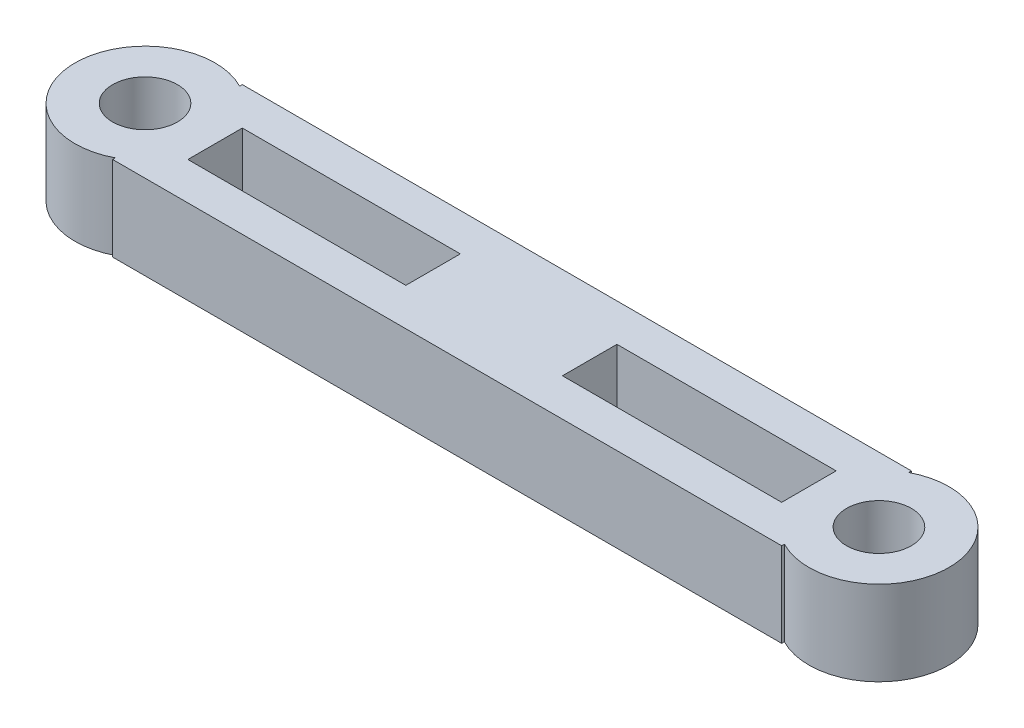
from build123d import *

# Parameters (mm, degrees)
SKETCH1_W                = 22.609360872
SKETCH1_H                = 4.3815
SKETCH1_W_2              = 7.366
SKETCH1_H_2              = 1.8415
SKETCH1_W_3              = 7.407296779
BOSS_EXTRUDE1_DEPTH      = 6.35
BOSS_EXTRUDE2_REACH      = 15.15
BOSS_EXTRUDE3_START      = 2.19075
BOSS_EXTRUDE3_DEPTH      = 2.19075
SKETCH7_R                = 1.5875
BOSS_EXTRUDE4_DEPTH      = 1.27
MIRROR2_COPY_1_SKETCH_R  = 1.5875
MIRROR2_COPY_1_DEPTH     = 1.27
BOSS_EXTRUDE5_DEPTH      = 6.35
BOSS_EXTRUDE5_DEPTH_BACK = 1.27
SKETCH8_R                = 0.635
SKETCH9_W                = 22.609360872
SKETCH9_H                = 6.35
BOSS_EXTRUDE6_DEPTH      = 4.3815
SKETCH10_W               = 6.35
SKETCH10_H               = 1.8415
CUT_EXTRUDE1_DEPTH       = 12.7
CUT_EXTRUDE2_DEPTH       = 23.114
CUT_EXTRUDE2_DEPTH_BACK  = 4.7625
SKETCH12_W               = 31.633822951
SKETCH12_H               = 14.456952732
SKETCH13_W               = 7.366
SKETCH13_H               = 1.8415
SKETCH13_W_2             = 7.407296779
CUT_EXTRUDE3_DEPTH       = 12.7
SKETCH15_W               = 5.299628269
SKETCH15_H               = 4.3815
SKETCH15_W_2             = 5.528427798
CUT_EXTRUDE5_DEPTH       = 2.8575
SKETCH14_R               = 2.367055436
SKETCH14_R_2             = 1.095375
BOSS_EXTRUDE9_DEPTH      = 2.8575


with BuildPart() as part:
    # Sketch1 → Boss-Extrude1 (new body)
    with BuildSketch(Plane(origin=(0, 0, 0), x_dir=(1, 0, 0), z_dir=(0, 1, 0))):
        Rectangle(SKETCH1_W, SKETCH1_H)
        with Locations((-6.35, 0)):
            Rectangle(SKETCH1_W_2, SKETCH1_H_2, mode=Mode.SUBTRACT)
        with Locations((6.329351611, 0)):
            Rectangle(SKETCH1_W_3, SKETCH1_H_2, mode=Mode.SUBTRACT)
    extrude(amount=BOSS_EXTRUDE1_DEPTH)

    # Boss-Extrude2: up to this face of the body (flat: up to its plane)
    boss_extrude2_end = Plane(part.part.faces().sort_by_distance((0, 3.175, -2.19075))[0])
    # Sketch2 → Boss-Extrude2 (add, up to the picked face)
    with BuildSketch(Plane.XY, mode=Mode.PRIVATE) as boss_extrude2_sk1:
        with BuildLine():
            Line((3.175, 0), (-3.175, 0))
            ThreePointArc((-3.175, 0), (0, -3.175), (3.175, 0))
        make_face()
    boss_extrude2_tool1 = split(extrude(boss_extrude2_sk1.sketch, amount=-BOSS_EXTRUDE2_REACH, mode=Mode.PRIVATE), bisect_by=boss_extrude2_end, keep=Keep.BOTH, mode=Mode.PRIVATE)
    add(boss_extrude2_tool1.solids().sort_by(Axis((0, -1.347512, 0), (0, 0, -1)))[0])

    # Sketch2<3> → Boss-Extrude3 (add)
    with BuildSketch(Plane.XY.offset(BOSS_EXTRUDE3_START)):
        with BuildLine():
            Line((3.175, 0), (-3.175, 0))
            ThreePointArc((-3.175, 0), (0, -3.175), (3.175, 0))
        make_face()
    extrude(amount=-BOSS_EXTRUDE3_DEPTH)

    # Sketch7 → Boss-Extrude4 (add)
    with BuildSketch(Plane.XY.offset(2.19075)):
        with BuildLine():
            Line((-9.525, 0), (-11.304680436, 0))
            Line((-11.304680436, 0), (-11.304680436, -12.7))
            ThreePointArc((-11.304680436, -12.7), (-8.266575896, -13.958424104), (-9.525, -10.920319564))
            Line((-9.525, -10.920319564), (-9.525, 0))
        make_face()
        with Locations((-9.525, -12.7)):
            Circle(SKETCH7_R, mode=Mode.SUBTRACT)
    boss_extrude4 = extrude(amount=-BOSS_EXTRUDE4_DEPTH)

    # Mirror1: Boss-Extrude4 across plane
    add(boss_extrude4.mirror(Plane(origin=(0, 0, 0), x_dir=(0, 0, 1), z_dir=(1, 0, 0))))

    # Mirror2: Boss-Extrude4 across plane
    add(boss_extrude4.mirror(Plane.XY))

    # Mirror2 copy 1 sketch → Mirror2 copy 1 (add)
    with BuildSketch(Plane(origin=(0, 0, -2.19075), x_dir=(-1, 0, 0), z_dir=(0, 0, -1))):
        with BuildLine():
            Line((-9.525, 0), (-11.304680436, 0))
            Line((-11.304680436, 0), (-11.304680436, -12.7))
            ThreePointArc((-11.304680436, -12.7), (-8.266575896, -13.958424104), (-9.525, -10.920319564))
            Line((-9.525, -10.920319564), (-9.525, 0))
        make_face()
        with Locations((-9.525, -12.7)):
            Circle(MIRROR2_COPY_1_SKETCH_R, mode=Mode.SUBTRACT)
    extrude(amount=-MIRROR2_COPY_1_DEPTH)

    # Sketch8 → Boss-Extrude5 (add, two sides: drawn at the far end of the back side and taken through both)
    # profile 1 of 2: a face of its own
    with BuildSketch(Plane(origin=(0, 6.35, 0), x_dir=(1, 0, 0), z_dir=(0, 1, 0)).offset(-BOSS_EXTRUDE5_DEPTH_BACK)):
        with BuildLine():
            Line((-11.304680436, 2.19075), (-11.304680436, -2.19075))
            ThreePointArc((-11.304680436, -2.19075), (-13.495430436, 0), (-11.304680436, 2.19075))
        make_face()
        with Locations(Location((-12.400055436, 0, 0), (0, 0, 270))):
            Circle(SKETCH8_R, mode=Mode.SUBTRACT)
    # profile 2 of 2: a face of its own
    with BuildSketch(Plane(origin=(0, 6.35, 0), x_dir=(1, 0, 0), z_dir=(0, 1, 0)).offset(-BOSS_EXTRUDE5_DEPTH_BACK)):
        with BuildLine():
            Line((11.304680436, 2.19075), (11.304680436, -2.19075))
            ThreePointArc((11.304680436, -2.19075), (13.495430436, 0), (11.304680436, 2.19075))
        make_face()
        with Locations(Location((12.400055436, 0, 0), (0, 0, 90))):
            Circle(SKETCH8_R, mode=Mode.SUBTRACT)
    extrude(amount=BOSS_EXTRUDE5_DEPTH + BOSS_EXTRUDE5_DEPTH_BACK)

    # Sketch9 → Boss-Extrude6 (add)
    with BuildSketch(Plane(origin=(0, 0, -2.19075), x_dir=(-1, 0, 0), z_dir=(0, 0, -1))):
        with Locations((0, 9.525)):
            Rectangle(SKETCH9_W, SKETCH9_H)
    extrude(amount=-BOSS_EXTRUDE6_DEPTH)

    # Sketch10 → Cut-Extrude1 (cut)
    with BuildSketch(Plane(origin=(0, 12.7, 0), x_dir=(1, 0, 0), z_dir=(0, 1, 0))):
        with Locations((6.308703221, 0)):
            Rectangle(SKETCH10_W, SKETCH10_H)
        with Locations((-6.35, 0)):
            Rectangle(SKETCH10_W, SKETCH10_H)
    extrude(amount=-CUT_EXTRUDE1_DEPTH, mode=Mode.SUBTRACT)

    # Sketch12 → Cut-Extrude2 (cut, two sides: drawn at the far end of the back side and taken through both)
    with BuildSketch(Plane(origin=(0, 5.08, 0), x_dir=(-1, 0, 0), z_dir=(0, -1, 0)).offset(-CUT_EXTRUDE2_DEPTH_BACK)):
        with Locations((-0.08433307, 1.389523064)):
            Rectangle(SKETCH12_W, SKETCH12_H)
    extrude(amount=CUT_EXTRUDE2_DEPTH + CUT_EXTRUDE2_DEPTH_BACK, mode=Mode.SUBTRACT)

    # Sketch13 → Cut-Extrude3 (cut)
    with BuildSketch(Plane(origin=(0, 0, 0), x_dir=(1, 0, 0), z_dir=(0, 1, 0))):
        with Locations((-6.35, 0)):
            Rectangle(SKETCH13_W, SKETCH13_H)
        with Locations((6.329351611, 0)):
            Rectangle(SKETCH13_W_2, SKETCH13_H)
    extrude(amount=CUT_EXTRUDE3_DEPTH, mode=Mode.SUBTRACT)

    # Sketch15 → Cut-Extrude5 (cut)
    with BuildSketch(Plane(origin=(0, 12.7, 0), x_dir=(1, 0, 0), z_dir=(0, 1, 0))):
        with Locations((-13.95449457, 0)):
            Rectangle(SKETCH15_W, SKETCH15_H)
        with Locations((14.068894335, 0)):
            Rectangle(SKETCH15_W_2, SKETCH15_H)
    extrude(amount=-CUT_EXTRUDE5_DEPTH, mode=Mode.SUBTRACT)

    # Sketch14 → Boss-Extrude9 (add)
    # profile 1 of 2: a face of its own
    with BuildSketch(Plane(origin=(0, 12.7, 0), x_dir=(1, 0, 0), z_dir=(0, 1, 0))):
        with Locations((-12.400055436, 0)):
            Circle(SKETCH14_R)
        with Locations(Location((-12.400055436, 0, 0), (0, 0, 270))):
            Circle(SKETCH14_R_2, mode=Mode.SUBTRACT)
    # profile 2 of 2: a face of its own
    with BuildSketch(Plane(origin=(0, 12.7, 0), x_dir=(1, 0, 0), z_dir=(0, 1, 0))):
        with Locations((12.400055436, 0)):
            Circle(SKETCH14_R)
        with Locations(Location((12.400055436, 0, 0), (0, 0, 270))):
            Circle(SKETCH14_R_2, mode=Mode.SUBTRACT)
    extrude(amount=-BOSS_EXTRUDE9_DEPTH)


solid = part.part
